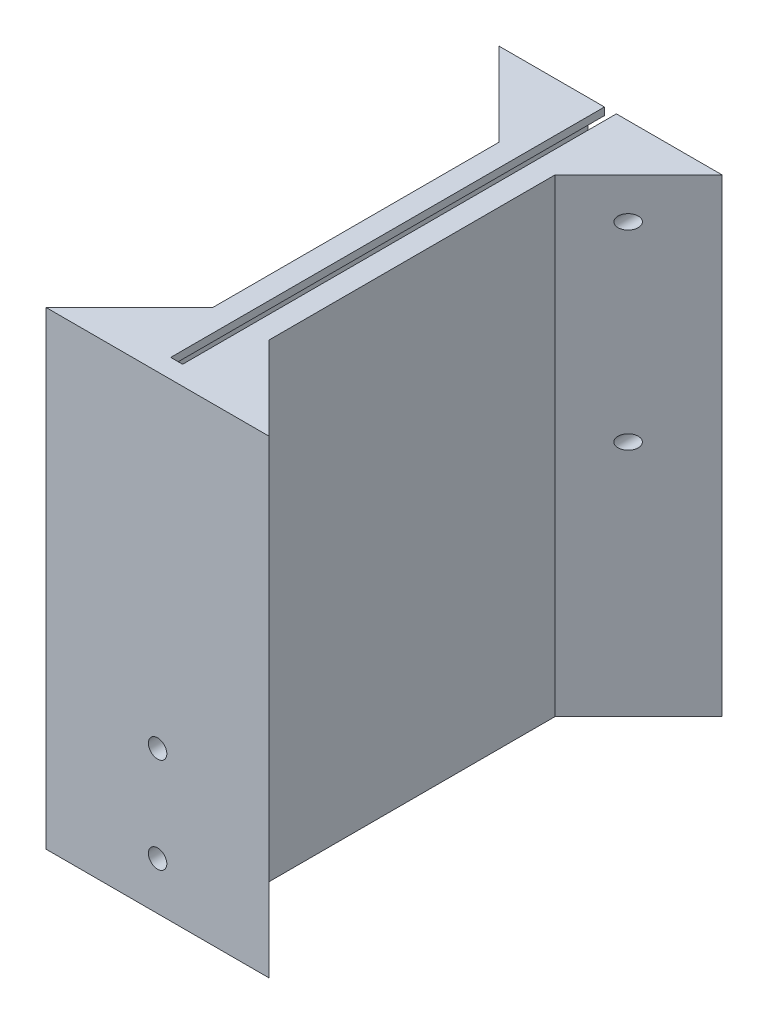
from build123d import *

# Parameters (mm, degrees)
BOSS_EXTRUDE1_DEPTH            = 125
SKETCH3_W                      = 12
SKETCH3_H                      = 68
CUT_EXTRUDE1_DEPTH             = 115.57
SKETCH4_W                      = 3.175
SKETCH4_H                      = 115.57
CUT_EXTRUDE2_DEPTH             = 3
CUT_EXTRUDE3_REACH             = 143.943
SKETCH5_W                      = 8
SKETCH5_H                      = 19.05
SKETCH6_R                      = 2.45745
CUT_EXTRUDE4_DEPTH             = 25.4
CUT_EXTRUDE5_START             = -25.4
SKETCH7_R                      = 2.45745
CUT_EXTRUDE5_DEPTH             = 25.4
TAP_DRILL_FOR_10_24_TAP1_D     = 3.7973
TAP_DRILL_FOR_10_24_TAP1_DEPTH = 30
TAP_DRILL_FOR_10_24_TAP1_TIP   = 1.140824014


with BuildPart() as part:
    # Sketch1 → Boss-Extrude1 (new body)
    with BuildSketch(Plane(origin=(0, 0, 0), x_dir=(1, 0, 0), z_dir=(0, 1, 0))):
        Polygon((-29.725, -60.325), (29.725, -60.325), (7.5, -38.1), (7.5, 38.1), (29.725, 60.325), (-29.725, 60.325), (-7.5, 38.1), (-7.5, -38.1), align=None)
    extrude(amount=BOSS_EXTRUDE1_DEPTH)

    # Sketch3 → Cut-Extrude1 (cut)
    with BuildSketch(Plane(origin=(0, 0, -60.325), x_dir=(-1, 0, 0), z_dir=(0, 0, -1))):
        with Locations((0, 89)):
            Rectangle(SKETCH3_W, SKETCH3_H)
    extrude(amount=-CUT_EXTRUDE1_DEPTH, mode=Mode.SUBTRACT)

    # Sketch4 → Cut-Extrude2 (cut)
    with BuildSketch(Plane(origin=(0, 125, 0), x_dir=(1, 0, 0), z_dir=(0, 1, 0))):
        with Locations((0, 2.54)):
            Rectangle(SKETCH4_W, SKETCH4_H)
    extrude(amount=-CUT_EXTRUDE2_DEPTH, mode=Mode.SUBTRACT)

    # Sketch5 → Cut-Extrude3 (cut, up to next)
    with BuildSketch(Plane.XZ, mode=Mode.PRIVATE) as cut_extrude3_sk1:
        Rectangle(SKETCH5_W, SKETCH5_H)
    cut_extrude3_tool1 = extrude(cut_extrude3_sk1.sketch, amount=-CUT_EXTRUDE3_REACH, mode=Mode.PRIVATE) & part.part
    add(cut_extrude3_tool1.solids().sort_by_distance((0, 0, 0))[0], mode=Mode.SUBTRACT)

    # Sketch6 → Cut-Extrude4 (cut)
    with BuildSketch(Plane(origin=(0, 0, -60.325), x_dir=(-1, 0, 0), z_dir=(0, 0, -1))):
        with Locations((0, 12.7)):
            Circle(SKETCH6_R)
        with Locations((0, 38.1)):
            Circle(SKETCH6_R)
    extrude(amount=-CUT_EXTRUDE4_DEPTH, mode=Mode.SUBTRACT)

    # Sketch7 → Cut-Extrude5 (cut)
    with BuildSketch(Plane.XY.offset(60.325).offset(CUT_EXTRUDE5_START)):
        with Locations(Location((0, 38.1, 0), (0, 0, 180))):
            Circle(SKETCH7_R)
        with Locations(Location((0, 12.7, 0), (0, 0, 180))):
            Circle(SKETCH7_R)
    extrude(amount=CUT_EXTRUDE5_DEPTH, mode=Mode.SUBTRACT)

    # Tap Drill for #10-24 Tap1
    with Locations(Plane(origin=(0, 0, -60.325), x_dir=(-1, 0, 0), z_dir=(0, 0, -1))):
        with Locations((-17.225, 114.15), (-17.225, 63.35), (17.225, 114.15), (17.225, 63.35)):
            Hole(TAP_DRILL_FOR_10_24_TAP1_D / 2, depth=TAP_DRILL_FOR_10_24_TAP1_DEPTH)
            with Locations((0, 0, -(TAP_DRILL_FOR_10_24_TAP1_DEPTH + TAP_DRILL_FOR_10_24_TAP1_TIP / 2))):  # 118° drill point
                Cone(0, TAP_DRILL_FOR_10_24_TAP1_D / 2, TAP_DRILL_FOR_10_24_TAP1_TIP, mode=Mode.SUBTRACT)


solid = part.part
